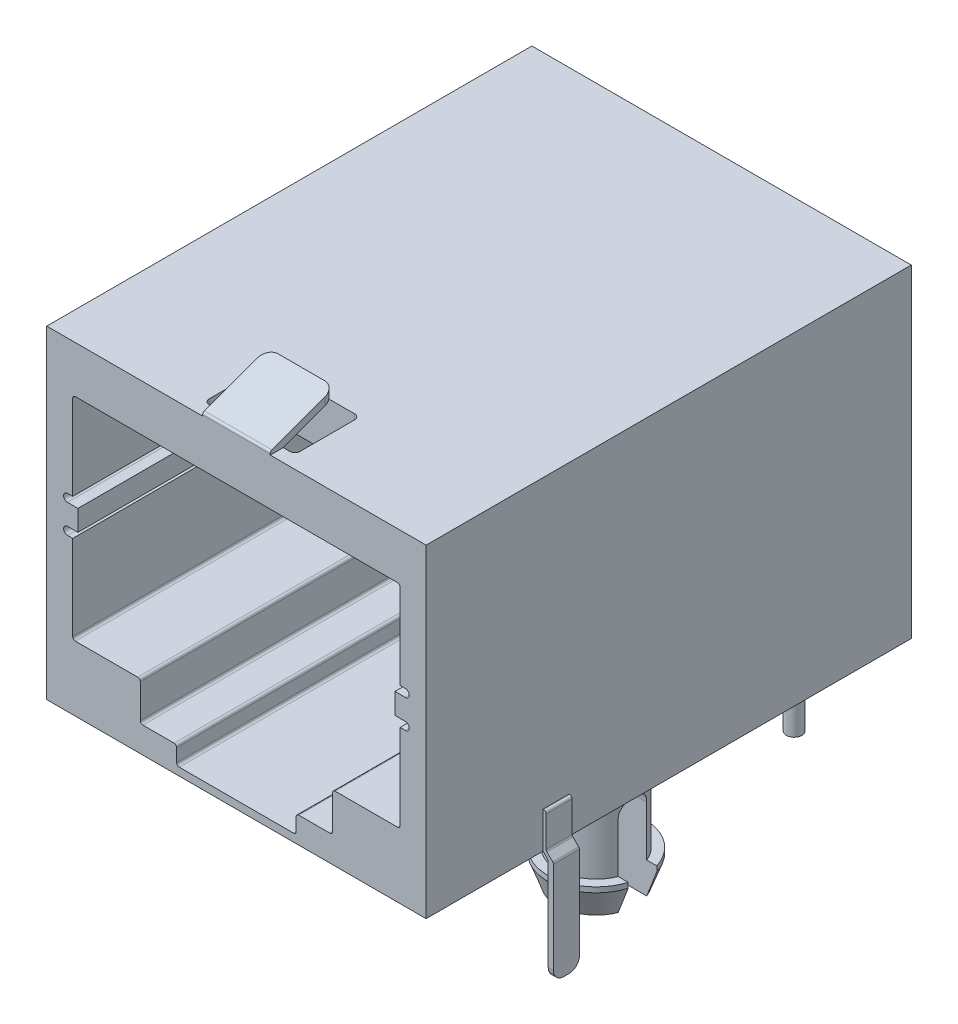
from build123d import *

# Parameters (mm, degrees)
RESSALTO_EXTRUS_O1_DEPTH           = 9.335
RESSALTO_EXTRUS_O1_DEPTH_BACK      = 9.335
ESBO_O1_W                          = 14.6
ESBO_O1_H                          = 12.45
CORTE_EXTRUS_O1_DEPTH              = 13
ESBO_O3_R                          = 1.5
ESBO_O3_R_2                        = 0.3
RESSALTO_EXTRUS_O2_DEPTH           = 3.68
ESBO_O4_R                          = 1.5
RESSALTO_EXTRUS_O3_DEPTH           = 1
RESSALTO_EXTRUS_O3_DRAFT           = 20
RESSALTO_EXTRUS_O3_PROFILE_2_DEPTH = 1
RESSALTO_EXTRUS_O3_PROFILE_2_DRAFT = 20
ESBO_O5_R                          = 1.863970234
RESSALTO_EXTRUS_O4_DEPTH           = 0.2
ESBO_O7_W                          = 1.3
ESBO_O7_H                          = 4.5
ESBO_O7_H_2                        = 0.866927726
RESSALTO_EXTRUS_O5_DEPTH           = 0.5
CORTE_EXTRUS_O2_DEPTH              = 22.822659788
CORTE_EXTRUS_O2_DEPTH_BACK         = 22.822659788
RESSALTO_EXTRUS_O6_DEPTH           = 0.5
RESSALTO_EXTRUS_O6_DEPTH_BACK      = 0.5
FILETE1_R                          = 0.4
ESBO_O11_W                         = 0.5
ESBO_O11_H                         = 4.075
RESSALTO_EXTRUS_O7_DEPTH           = 3
CHANFRO1_SIZE                      = 2
CORTE_EXTRUS_O3_REACH              = 22.567
RESSALTO_EXTRUS_O8_DEPTH           = 1.3
RESSALTO_EXTRUS_O8_DEPTH_BACK      = 1.3
FILETE2_R                          = 0.4


with BuildPart() as part:
    # Esboço1 → Ressalto-extrusão1 (new, two sides: drawn at the far end of the back side and taken through both)
    with BuildSketch(Plane.XY.offset(-RESSALTO_EXTRUS_O1_DEPTH_BACK)):
        with Locations((0, 6.725)):
            Rectangle(ESBO_O1_W, ESBO_O1_H)
    extrude(amount=RESSALTO_EXTRUS_O1_DEPTH + RESSALTO_EXTRUS_O1_DEPTH_BACK)

    # Esboço2 → Corte-extrusão1 (cut)
    with BuildSketch(Plane.XY.offset(9.335)):
        with BuildLine():
            Line((6.2, 11.15), (-6.2, 11.15))
            ThreePointArc((-6.2, 11.15), (-6.270710678, 11.120710678), (-6.3, 11.05))
            Line((-6.3, 11.05), (-6.3, 7.775))
            Line((-6.3, 7.775), (-6.5, 7.775))
            ThreePointArc((-6.5, 7.775), (-6.65, 7.625), (-6.5, 7.475))
            Line((-6.5, 7.475), (-6.1, 7.475))
            Line((-6.1, 7.475), (-6.1, 6.675))
            Line((-6.1, 6.675), (-6.5, 6.675))
            ThreePointArc((-6.5, 6.675), (-6.65, 6.525), (-6.5, 6.375))
            Line((-6.5, 6.375), (-6.3, 6.375))
            Line((-6.3, 6.375), (-6.3, 3.1))
            ThreePointArc((-6.3, 3.1), (-6.270710678, 3.029289322), (-6.2, 3))
            Line((-6.2, 3), (-3.8, 3))
            ThreePointArc((-3.8, 3), (-3.729289322, 2.970710678), (-3.7, 2.9))
            Line((-3.7, 2.9), (-3.7, 1.6))
            ThreePointArc((-3.7, 1.6), (-3.670710678, 1.529289322), (-3.6, 1.5))
            Line((-3.6, 1.5), (-2.4, 1.5))
            ThreePointArc((-2.4, 1.5), (-2.329289322, 1.470710678), (-2.3, 1.4))
            Line((-2.3, 1.4), (-2.3, 0.9))
            ThreePointArc((-2.3, 0.9), (-2.270710678, 0.829289322), (-2.2, 0.8))
            Line((-2.2, 0.8), (2.2, 0.8))
            ThreePointArc((2.2, 0.8), (2.270710678, 0.829289322), (2.3, 0.9))
            Line((2.3, 0.9), (2.3, 1.4))
            ThreePointArc((2.3, 1.4), (2.329289322, 1.470710678), (2.4, 1.5))
            Line((2.4, 1.5), (3.6, 1.5))
            ThreePointArc((3.6, 1.5), (3.670710678, 1.529289322), (3.7, 1.6))
            Line((3.7, 1.6), (3.7, 2.9))
            ThreePointArc((3.7, 2.9), (3.729289322, 2.970710678), (3.8, 3))
            Line((3.8, 3), (6.2, 3))
            ThreePointArc((6.2, 3), (6.270710678, 3.029289322), (6.3, 3.1))
            Line((6.3, 3.1), (6.3, 6.375))
            Line((6.3, 6.375), (6.5, 6.375))
            ThreePointArc((6.5, 6.375), (6.65, 6.525), (6.5, 6.675))
            Line((6.5, 6.675), (6.1, 6.675))
            Line((6.1, 6.675), (6.1, 7.475))
            Line((6.1, 7.475), (6.5, 7.475))
            ThreePointArc((6.5, 7.475), (6.65, 7.625), (6.5, 7.775))
            Line((6.5, 7.775), (6.3, 7.775))
            Line((6.3, 7.775), (6.3, 11.05))
            ThreePointArc((6.3, 11.05), (6.270710678, 11.120710678), (6.2, 11.15))
        make_face()
    extrude(amount=-CORTE_EXTRUS_O1_DEPTH, mode=Mode.SUBTRACT)

    # Esboço3 → Ressalto-extrusão2 (add)
    with BuildSketch(Plane.XZ.offset(-0.5)):
        with Locations((-5.715, 1.205)):
            Circle(ESBO_O3_R)
        with Locations((-4.445, -5.145)):
            Circle(ESBO_O3_R_2)
        with Locations((-3.175, -7.685)):
            Circle(ESBO_O3_R_2)
        with Locations((5.715, 1.205)):
            Circle(ESBO_O3_R)
        with Locations((-1.905, -5.145)):
            Circle(ESBO_O3_R_2)
        with Locations((-0.635, -7.685)):
            Circle(ESBO_O3_R_2)
        with Locations((0.635, -5.145)):
            Circle(ESBO_O3_R_2)
        with Locations((1.905, -7.685)):
            Circle(ESBO_O3_R_2)
        with Locations((3.175, -5.145)):
            Circle(ESBO_O3_R_2)
        with Locations((4.445, -7.685)):
            Circle(ESBO_O3_R_2)
    extrude(amount=RESSALTO_EXTRUS_O2_DEPTH)


with BuildPart() as ressalto_extrus_o3_tool:
    # Esboço4 → Ressalto-extrusão3 (with draft: the straight prism first)
    with BuildSketch(Plane.XZ.offset(3.18)):
        with Locations((-5.715, 1.205)):
            Circle(ESBO_O4_R)
    extrude(amount=-RESSALTO_EXTRUS_O3_DEPTH)
    # Ressalto-extrusão3: the draft: its side faces are tilted about the plane it starts from
    ressalto_extrus_o3_sides = [ressalto_extrus_o3_tool.faces().sort_by_distance(p)[0] for p in [
        (-7.215, -2.68, 1.205),
    ]]
    draft(ressalto_extrus_o3_sides, Plane.XZ.offset(3.18), RESSALTO_EXTRUS_O3_DRAFT)


with BuildPart() as part_1:
    add(part.part)

    # Ressalto-extrusão3: add ressalto_extrus_o3_tool
    add(ressalto_extrus_o3_tool.part)


with BuildPart() as ressalto_extrus_o3_profile_2_tool:
    # Esboço4 → Ressalto-extrusão3 profile 2 (with draft: the straight prism first)
    with BuildSketch(Plane.XZ.offset(3.18)):
        with Locations((5.715, 1.205)):
            Circle(ESBO_O4_R)
    extrude(amount=-RESSALTO_EXTRUS_O3_PROFILE_2_DEPTH)
    # Ressalto-extrusão3 profile 2: the draft: its side faces are tilted about the plane it starts from
    ressalto_extrus_o3_profile_2_sides = [ressalto_extrus_o3_profile_2_tool.faces().sort_by_distance(p)[0] for p in [
        (4.215, -2.68, 1.205),
    ]]
    draft(ressalto_extrus_o3_profile_2_sides, Plane.XZ.offset(3.18), RESSALTO_EXTRUS_O3_PROFILE_2_DRAFT)


with BuildPart() as part_2:
    add(part_1.part)

    # Ressalto-extrusão3 profile 2: add ressalto_extrus_o3_profile_2_tool
    add(ressalto_extrus_o3_profile_2_tool.part)

    # Esboço5 → Ressalto-extrusão4 (add)
    with BuildSketch(Plane(origin=(0, -2.18, 0), x_dir=(1, 0, 0), z_dir=(0, 1, 0))):
        with Locations((-5.715, -1.205)):
            Circle(ESBO_O5_R)
        with Locations((5.715, -1.205)):
            Circle(ESBO_O5_R)
    extrude(amount=RESSALTO_EXTRUS_O4_DEPTH)

    # Esboço7 → Ressalto-extrusão5 (add)
    with BuildSketch(Plane.XZ.offset(-0.5)):
        with Locations((-3.175, 4.902153743)):
            Rectangle(ESBO_O7_W, ESBO_O7_H)
        with Locations((-3.175, -8.712623651)):
            Rectangle(ESBO_O7_W, ESBO_O7_H_2)
        with Locations((3.175, -8.712623651)):
            Rectangle(ESBO_O7_W, ESBO_O7_H_2)
        with Locations((3.175, 4.902153743)):
            Rectangle(ESBO_O7_W, ESBO_O7_H)
    extrude(amount=RESSALTO_EXTRUS_O5_DEPTH)

    # Esboço8 → Corte-extrusão2 (cut, two sides: drawn at the far end of the back side and taken through both)
    with BuildSketch(Plane(origin=(7.3, 0, 0), x_dir=(0, 0, -1), z_dir=(1, 0, 0)).offset(-CORTE_EXTRUS_O2_DEPTH_BACK)):
        with BuildLine():
            Line((-1.755, -0.05), (-1.755, -3.18))
            Line((-1.755, -3.18), (-0.655, -3.18))
            Line((-0.655, -3.18), (-0.655, -0.05))
            ThreePointArc((-0.655, -0.05), (-1.205, 0.5), (-1.755, -0.05))
        make_face()
    extrude(amount=CORTE_EXTRUS_O2_DEPTH + CORTE_EXTRUS_O2_DEPTH_BACK, mode=Mode.SUBTRACT)

    # Esboço9 → Ressalto-extrusão6 (add, two sides: drawn at the far end of the back side and taken through both)
    with BuildSketch(Plane.XY.offset(4.335).offset(-RESSALTO_EXTRUS_O6_DEPTH_BACK)):
        with BuildLine():
            Line((-7.3, 1.9), (-7.32, 1.9))
            ThreePointArc((-7.32, 1.9), (-7.390710678, 1.870710678), (-7.42, 1.8))
            Line((-7.42, 1.8), (-7.42, 0.621421356))
            ThreePointArc((-7.42, 0.621421356), (-7.427612047, 0.583153013), (-7.449289322, 0.550710678))
            Line((-7.449289322, 0.550710678), (-7.670710678, 0.329289322))
            ThreePointArc((-7.670710678, 0.329289322), (-7.692387953, 0.296846987), (-7.7, 0.258578644))
            Line((-7.7, 0.258578644), (-7.7, -3.68))
            Line((-7.7, -3.68), (-7.5, -3.68))
            Line((-7.5, -3.68), (-7.5, 0.258578644))
            ThreePointArc((-7.5, 0.258578644), (-7.492387953, 0.296846987), (-7.470710678, 0.329289322))
            Line((-7.470710678, 0.329289322), (-7.3, 0.5))
            Line((-7.3, 0.5), (-7.3, 1.9))
        make_face()
        with BuildLine():
            Line((7.3, 1.9), (7.3, 0.5))
            Line((7.3, 0.5), (7.470710678, 0.329289322))
            ThreePointArc((7.470710678, 0.329289322), (7.492387953, 0.296846987), (7.5, 0.258578644))
            Line((7.5, 0.258578644), (7.5, -3.68))
            Line((7.5, -3.68), (7.7, -3.68))
            Line((7.7, -3.68), (7.7, 0.258578644))
            ThreePointArc((7.7, 0.258578644), (7.692387953, 0.296846987), (7.670710678, 0.329289322))
            Line((7.670710678, 0.329289322), (7.449289322, 0.550710678))
            ThreePointArc((7.449289322, 0.550710678), (7.427612047, 0.583153013), (7.42, 0.621421356))
            Line((7.42, 0.621421356), (7.42, 1.8))
            ThreePointArc((7.42, 1.8), (7.390710678, 1.870710678), (7.32, 1.9))
            Line((7.32, 1.9), (7.3, 1.9))
        make_face()
    extrude(amount=RESSALTO_EXTRUS_O6_DEPTH + RESSALTO_EXTRUS_O6_DEPTH_BACK)

    # Filete1
    filete1_edges = [part_2.edges().sort_by_distance(p)[0] for p in [
        (-7.6, -3.68, 4.835),
        (-7.6, -3.68, 3.835),
        (7.6, -3.68, 3.835),
        (7.6, -3.68, 4.835),
    ]]
    fillet(filete1_edges, radius=FILETE1_R)

    # Esboço11 → Ressalto-extrusão7 (add)
    with BuildSketch(Plane.XY.offset(-3.665)):
        with Locations((-0.5, 9.1125)):
            Rectangle(ESBO_O11_W, ESBO_O11_H)
        with Locations((0.5, 9.1125)):
            Rectangle(ESBO_O11_W, ESBO_O11_H)
        with Locations((1.5, 9.1125)):
            Rectangle(ESBO_O11_W, ESBO_O11_H)
        with Locations((2.5, 9.1125)):
            Rectangle(ESBO_O11_W, ESBO_O11_H)
        with Locations((3.5, 9.1125)):
            Rectangle(ESBO_O11_W, ESBO_O11_H)
        with Locations((-1.5, 9.1125)):
            Rectangle(ESBO_O11_W, ESBO_O11_H)
        with Locations((-2.5, 9.1125)):
            Rectangle(ESBO_O11_W, ESBO_O11_H)
        with Locations((-3.5, 9.1125)):
            Rectangle(ESBO_O11_W, ESBO_O11_H)
    extrude(amount=RESSALTO_EXTRUS_O7_DEPTH)

    # Chanfro1
    chanfro1_edges = [part_2.edges().sort_by_distance(p)[0] for p in [
        (3.5, 7.075, -0.665),
        (2.5, 7.075, -0.665),
        (1.5, 7.075, -0.665),
        (0.5, 7.075, -0.665),
        (-0.5, 7.075, -0.665),
        (-1.5, 7.075, -0.665),
        (-2.5, 7.075, -0.665),
        (-3.5, 7.075, -0.665),
    ]]
    chamfer(chanfro1_edges, length=CHANFRO1_SIZE)

    # Esboço12 → Corte-extrusão3 (cut, up to next)
    with BuildSketch(Plane(origin=(0, 12.95, 0), x_dir=(1, 0, 0), z_dir=(0, 1, 0)), mode=Mode.PRIVATE) as corte_extrus_o3_sk1:
        with BuildLine():
            Line((-1.55, -6.335), (1.55, -6.335))
            ThreePointArc((1.55, -6.335), (1.691421356, -6.393578644), (1.75, -6.535))
            Line((1.75, -6.535), (1.75, -8.635))
            ThreePointArc((1.75, -8.635), (1.691421356, -8.776421356), (1.55, -8.835))
            Line((1.55, -8.835), (-1.55, -8.835))
            ThreePointArc((-1.55, -8.835), (-1.691421356, -8.776421356), (-1.75, -8.635))
            Line((-1.75, -8.635), (-1.75, -6.535))
            ThreePointArc((-1.75, -6.535), (-1.691421356, -6.393578644), (-1.55, -6.335))
        make_face()
    corte_extrus_o3_tool1 = extrude(corte_extrus_o3_sk1.sketch, amount=-CORTE_EXTRUS_O3_REACH, mode=Mode.PRIVATE) & part_2.part
    add(corte_extrus_o3_tool1.solids().sort_by_distance((0, 12.95, 7.585))[0], mode=Mode.SUBTRACT)

    # Esboço13 → Ressalto-extrusão8 (add, two sides: drawn at the far end of the back side and taken through both)
    with BuildSketch(Plane(origin=(0, 0, 0), x_dir=(0, 0, -1), z_dir=(1, 0, 0)).offset(-RESSALTO_EXTRUS_O8_DEPTH_BACK)):
        with BuildLine():
            Line((-9.269202014, 13.091963391), (-6.835, 13.977940469))
            Line((-6.835, 13.977940469), (-6.835, 13.677940469))
            Line((-6.835, 13.677940469), (-8.835, 12.95))
            Line((-8.835, 12.95), (-9.335, 12.95))
            Line((-9.335, 12.95), (-9.335, 12.997994129))
            ThreePointArc((-9.335, 12.997994129), (-9.316915204, 13.055351773), (-9.269202014, 13.091963391))
        make_face()
    extrude(amount=RESSALTO_EXTRUS_O8_DEPTH + RESSALTO_EXTRUS_O8_DEPTH_BACK)

    # Filete2
    filete2_edges = [part_2.edges().sort_by_distance(p)[0] for p in [
        (-1.3, 13.827940469, 6.835),
        (1.3, 13.827940469, 6.835),
    ]]
    fillet(filete2_edges, radius=FILETE2_R)


solid = part_2.part
